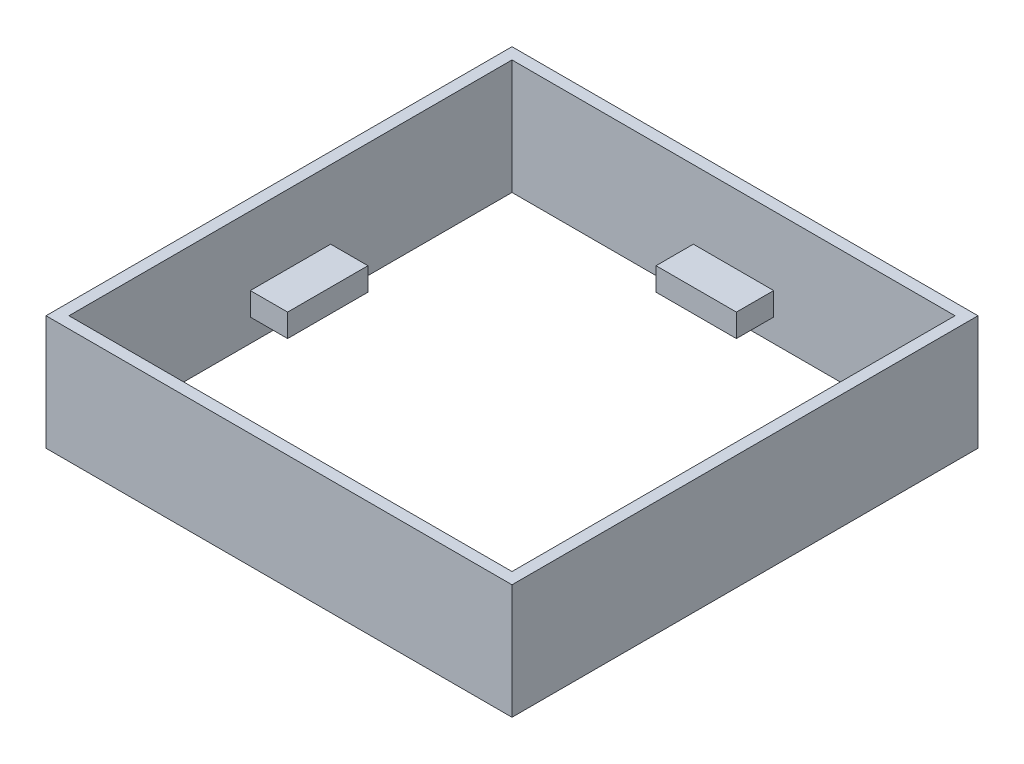
from build123d import *

# Parameters (mm, degrees)
SKETCH4_W           = 81.2
SKETCH4_H           = 81.2
SKETCH4_W_2         = 77.2
SKETCH4_H_2         = 77.2
BOSS_EXTRUDE1_DEPTH = 20
BOSS_EXTRUDE2_START = -4
SKETCH5_W           = 6.5
SKETCH5_H           = 14
BOSS_EXTRUDE2_DEPTH = 4
CUT_EXTRUDE2_START  = -5
SKETCH5_3_W         = 3
SKETCH5_3_H         = 10
CUT_EXTRUDE2_DEPTH  = 2
CIRPATTERN2_COUNT   = 4


with BuildPart() as part:
    # Sketch4 → Boss-Extrude1 (new body)
    with BuildSketch(Plane(origin=(0, 0, 0), x_dir=(1, 0, 0), z_dir=(0, 1, 0))):
        Rectangle(SKETCH4_W, SKETCH4_H)
        Rectangle(SKETCH4_W_2, SKETCH4_H_2, mode=Mode.SUBTRACT)
    extrude(amount=-BOSS_EXTRUDE1_DEPTH)

    # Sketch5 → Boss-Extrude2 (add)
    with BuildSketch(Plane.XZ.offset(20).offset(BOSS_EXTRUDE2_START)):
        with Locations((-35.35, 0)):
            Rectangle(SKETCH5_W, SKETCH5_H)
    boss_extrude2 = extrude(amount=-BOSS_EXTRUDE2_DEPTH)

    # Sketch5<3> → Cut-Extrude2 (cut)
    with BuildSketch(Plane.XZ.offset(20).offset(CUT_EXTRUDE2_START)):
        with Locations((-35.1, 0)):
            Rectangle(SKETCH5_3_W, SKETCH5_3_H)
    cut_extrude2 = extrude(amount=-CUT_EXTRUDE2_DEPTH, mode=Mode.SUBTRACT)

    # CirPattern2: Boss-Extrude2, Cut-Extrude2 ×4 about axis
    cirpattern2_axis = Axis((0, 0, 0), (0, -1, 0))
    add([boss_extrude2.rotate(cirpattern2_axis, i * 360 / CIRPATTERN2_COUNT) for i in range(1, CIRPATTERN2_COUNT)])
    add([cut_extrude2.rotate(cirpattern2_axis, i * 360 / CIRPATTERN2_COUNT) for i in range(1, CIRPATTERN2_COUNT)], mode=Mode.SUBTRACT)


solid = part.part
